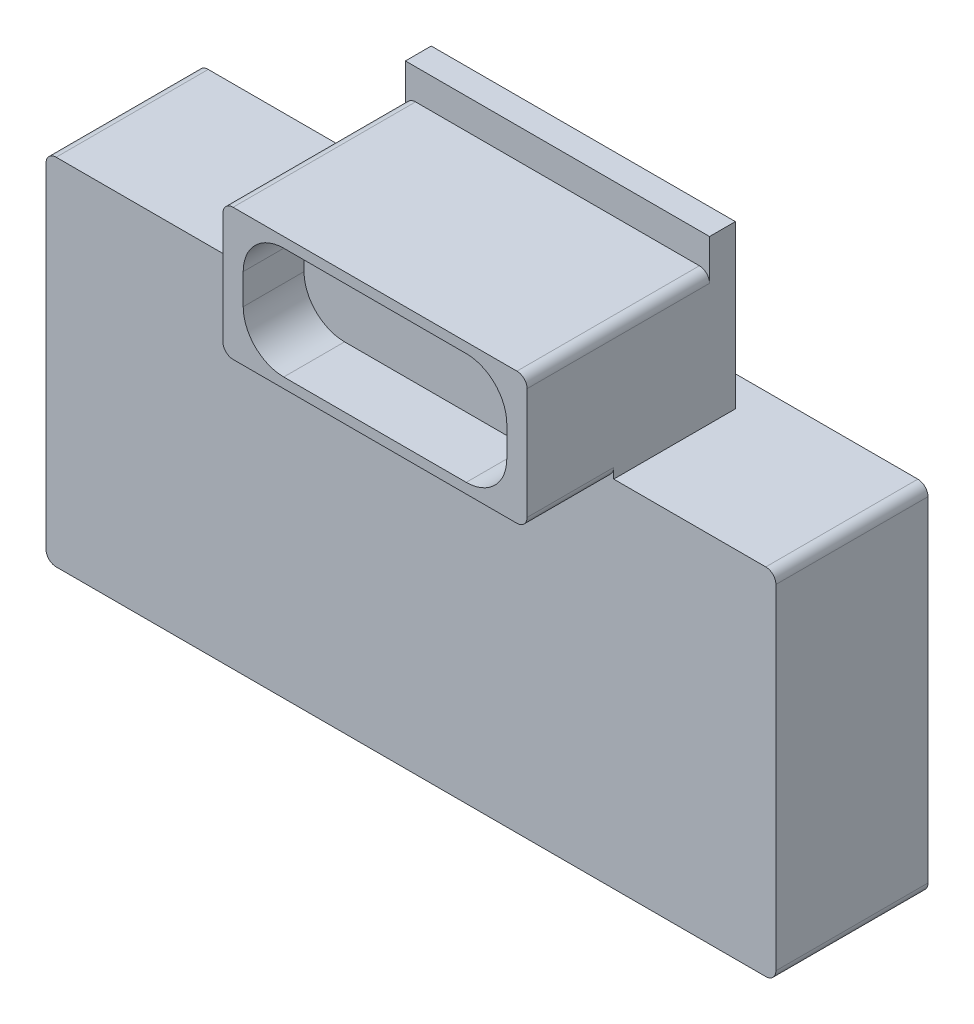
from build123d import *

# Parameters (mm, degrees)
SKETCH_1_W          = 72
SKETCH_1_H          = 35
EXTRUDE_1_DEPTH     = 15
SKETCH_2_W          = 30
SKETCH_2_H          = 2.549015657
EXTRUDE_2_DEPTH     = 16
SKETCH_3_W          = 30
SKETCH_3_H          = 13
EXTRUDE_3_DEPTH     = 18
SKETCH_4_W          = 26
SKETCH_4_H          = 11
CUT_EXTRUDE_1_DEPTH = 6
FILLET_1_R          = 4
FILLET_3_R          = 4
FILLET_2_R          = 1


with BuildPart() as part:
    # ｽｹｯﾁ1 → ﾎﾞｽ - 押し出し1 (new body)
    with BuildSketch(Plane.XY):
        with Locations((36, 17.5)):
            Rectangle(SKETCH_1_W, SKETCH_1_H)
    extrude(amount=EXTRUDE_1_DEPTH)

    # ｽｹｯﾁ2 → ﾎﾞｽ - 押し出し2 (add)
    with BuildSketch(Plane(origin=(0, 35, 0), x_dir=(1, 0, 0), z_dir=(0, 1, 0))):
        with Locations((41, -4.274507828)):
            Rectangle(SKETCH_2_W, SKETCH_2_H)
    extrude(amount=EXTRUDE_2_DEPTH)

    # ｽｹｯﾁ3 → ﾎﾞｽ - 押し出し3 (add)
    with BuildSketch(Plane.XY.offset(5.549015657)):
        with Locations((41, 41.5)):
            Rectangle(SKETCH_3_W, SKETCH_3_H)
    extrude(amount=EXTRUDE_3_DEPTH)

    # ｽｹｯﾁ4 → ｶｯﾄ - 押し出し1 (cut)
    with BuildSketch(Plane.XY.offset(23.549015657)):
        with Locations((41, 41.5)):
            Rectangle(SKETCH_4_W, SKETCH_4_H)
    extrude(amount=-CUT_EXTRUDE_1_DEPTH, mode=Mode.SUBTRACT)

    # ﾌｨﾚｯﾄ1
    fillet_1_edges = [part.edges().sort_by_distance(p)[0] for p in [
        (28, 36, 20.549015657),
        (28, 47, 20.549015657),
        (54, 47, 20.549015657),
        (54, 36, 20.549015657),
    ]]
    fillet(fillet_1_edges, radius=FILLET_1_R)

    # ﾌｨﾚｯﾄ3
    fillet_3_edges = [part.edges().sort_by_distance(p)[0] for p in [
        (26, 35, 9),
    ]]
    fillet(fillet_3_edges, radius=FILLET_3_R)

    # ﾌｨﾚｯﾄ2
    fillet_2_edges = [part.edges().sort_by_distance(p)[0] for p in [
        (26, 35, 19.274507829),
        (26, 48, 14.549015657),
        (56, 35, 19.274507829),
        (56, 48, 14.549015657),
        (0, 35, 7.5),
        (72, 35, 7.5),
        (72, 0, 7.5),
        (0, 0, 7.5),
    ]]
    fillet(fillet_2_edges, radius=FILLET_2_R)


solid = part.part
